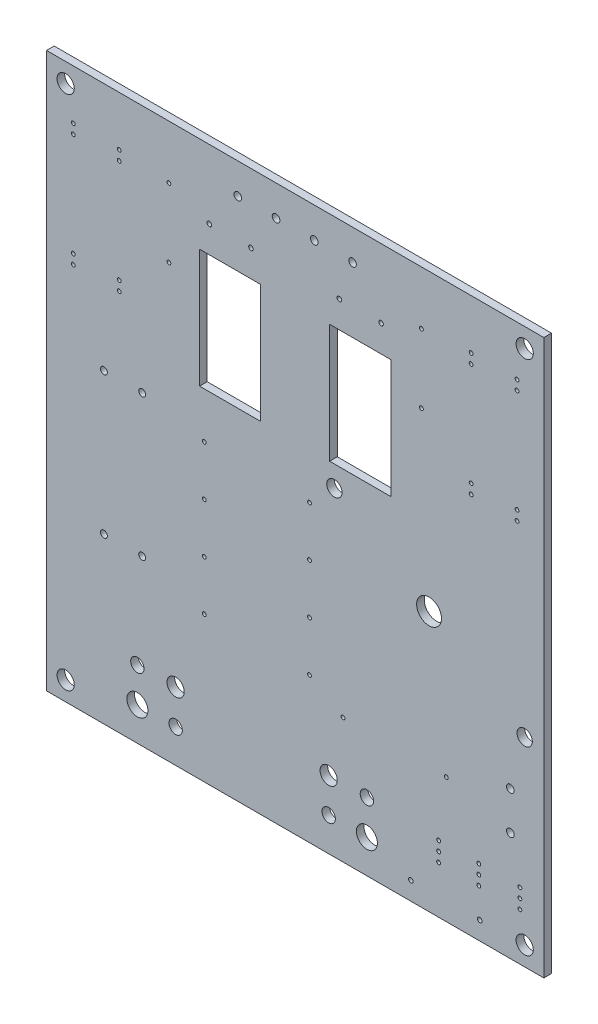
from build123d import *

# Parameters (mm, degrees)
SKETCH_1_W          = 130
SKETCH_1_H          = 145
SKETCH_1_R          = 2.25
SKETCH_1_R_2        = 3.25
EXTRUDE_1_DEPTH     = 2
SKETCH_2_R          = 1.75
SKETCH_2_R_2        = 0.5
SKETCH_2_R_3        = 1
SKETCH_2_R_4        = 2
SKETCH_2_R_5        = 2.75
SKETCH_2_R_6        = 2.25
CUT_EXTRUDE_1_DEPTH = 2
SKETCH_3_R          = 1
SKETCH_3_R_2        = 0.6
SKETCH_3_W          = 16
SKETCH_3_H          = 31
CUT_EXTRUDE_2_DEPTH = 2
SKETCH_4_R          = 0.9
SKETCH_4_R_2        = 0.5
SKETCH_4_R_3        = 0.6
CUT_EXTRUDE_3_DEPTH = 2
SKETCH_5_R          = 0.5
CUT_EXTRUDE_4_DEPTH = 2


with BuildPart() as part:
    # Эскиз1 → Вытянуть1 (new body)
    with BuildSketch(Plane.XY):
        Rectangle(SKETCH_1_W, SKETCH_1_H)
        with Locations((-60, -67.5)):
            Circle(SKETCH_1_R, mode=Mode.SUBTRACT)
        with Locations((60, -67.5)):
            Circle(SKETCH_1_R, mode=Mode.SUBTRACT)
        with Locations((60, 67.5)):
            Circle(SKETCH_1_R, mode=Mode.SUBTRACT)
        with Locations((-60, 67.5)):
            Circle(SKETCH_1_R, mode=Mode.SUBTRACT)
        with Locations((35, -4.5)):
            Circle(SKETCH_1_R_2, mode=Mode.SUBTRACT)
    extrude(amount=EXTRUDE_1_DEPTH)

    # Эскиз2 → Вырез-Вытянуть1 (cut)
    with BuildSketch(Plane.XY.offset(2)):
        with Locations((-41.25, -54.75)):
            Circle(SKETCH_2_R)
        with Locations((18.75, -54.75)):
            Circle(SKETCH_2_R)
        with Locations((37.5, -55.08)):
            Circle(SKETCH_2_R_2)
        with Locations((37.5, -57.58)):
            Circle(SKETCH_2_R_2)
        with Locations((37.5, -60.08)):
            Circle(SKETCH_2_R_2)
        with Locations((48, -57.58)):
            Circle(SKETCH_2_R_2)
        with Locations((48, -60.08)):
            Circle(SKETCH_2_R_2)
        with Locations((48, -55.08)):
            Circle(SKETCH_2_R_2)
        with Locations((58.75, -55.08)):
            Circle(SKETCH_2_R_2)
        with Locations((58.75, -57.58)):
            Circle(SKETCH_2_R_2)
        with Locations((58.75, -60.08)):
            Circle(SKETCH_2_R_2)
        with Locations((-15, 64.5)):
            Circle(SKETCH_2_R_3)
        with Locations((-5, 64.5)):
            Circle(SKETCH_2_R_3)
        with Locations((5, 64.5)):
            Circle(SKETCH_2_R_3)
        with Locations((15, 64.5)):
            Circle(SKETCH_2_R_3)
        with Locations((60, -20.5)):
            Circle(SKETCH_2_R_4)
        with Locations((10.25, 11)):
            Circle(SKETCH_2_R_4)
        with Locations((-41.25, -63.75)):
            Circle(SKETCH_2_R_5)
        with Locations((18.75, -63.75)):
            Circle(SKETCH_2_R_5)
        with Locations((-31.25, -63.75)):
            Circle(SKETCH_2_R)
        with Locations((8.75, -63.75)):
            Circle(SKETCH_2_R)
        with Locations((8.75, -54.75)):
            Circle(SKETCH_2_R_6)
        with Locations((-31.25, -54.75)):
            Circle(SKETCH_2_R_6)
    extrude(amount=-CUT_EXTRUDE_1_DEPTH, mode=Mode.SUBTRACT)

    # Эскиз3 → Вырез-Вытянуть2 (cut)
    with BuildSketch(Plane.XY.offset(2)):
        with Locations((56.25, -34)):
            Circle(SKETCH_3_R)
        with Locations((-22.45, 54.5)):
            Circle(SKETCH_3_R_2)
        with Locations((-11.55, 54.5)):
            Circle(SKETCH_3_R_2)
        with Locations((11.55, 54.5)):
            Circle(SKETCH_3_R_2)
        with Locations((22.45, 54.5)):
            Circle(SKETCH_3_R_2)
        with Locations((56.25, -44)):
            Circle(SKETCH_3_R)
        with Locations((17, 32)):
            Rectangle(SKETCH_3_W, SKETCH_3_H)
        with Locations((-17, 32)):
            Rectangle(SKETCH_3_W, SKETCH_3_H)
    extrude(amount=-CUT_EXTRUDE_2_DEPTH, mode=Mode.SUBTRACT)

    # Эскиз4 → Вырез-Вытянуть3 (cut)
    with BuildSketch(Plane.XY.offset(2)):
        with Locations((-50, 7.5)):
            Circle(SKETCH_4_R)
        with Locations((-40, 7.5)):
            Circle(SKETCH_4_R)
        with Locations((-40, -29.5)):
            Circle(SKETCH_4_R)
        with Locations((-50, -29.5)):
            Circle(SKETCH_4_R)
        with Locations((-23.75, -21.5)):
            Circle(SKETCH_4_R_2)
        with Locations((3.75, -21.5)):
            Circle(SKETCH_4_R_2)
        with Locations((-23.75, -34.5)):
            Circle(SKETCH_4_R_2)
        with Locations((3.75, -34.5)):
            Circle(SKETCH_4_R_2)
        with Locations((-23.75, -8.5)):
            Circle(SKETCH_4_R_2)
        with Locations((3.75, -8.5)):
            Circle(SKETCH_4_R_2)
        with Locations((-23.75, 4.5)):
            Circle(SKETCH_4_R_2)
        with Locations((3.75, 4.5)):
            Circle(SKETCH_4_R_2)
        with Locations((30.25, -67.75)):
            Circle(SKETCH_4_R_3)
        with Locations((48.25, -67.75)):
            Circle(SKETCH_4_R_3)
        with Locations((33, 40.5)):
            Circle(SKETCH_4_R_2)
        with Locations((33, 58.5)):
            Circle(SKETCH_4_R_2)
        with Locations((-33, 40.5)):
            Circle(SKETCH_4_R_2)
        with Locations((-33, 58.5)):
            Circle(SKETCH_4_R_2)
    extrude(amount=-CUT_EXTRUDE_3_DEPTH, mode=Mode.SUBTRACT)

    # Эскиз5 → Вырез-Вытянуть4 (cut)
    with BuildSketch(Plane.XY.offset(2)):
        with Locations((-58, 30)):
            Circle(SKETCH_5_R)
        with Locations((-58, 57)):
            Circle(SKETCH_5_R)
        with Locations((-46, 30)):
            Circle(SKETCH_5_R)
        with Locations((-46, 57)):
            Circle(SKETCH_5_R)
        with Locations((46, 30)):
            Circle(SKETCH_5_R)
        with Locations((46, 57)):
            Circle(SKETCH_5_R)
        with Locations((58, 30)):
            Circle(SKETCH_5_R)
        with Locations((58, 57)):
            Circle(SKETCH_5_R)
        with Locations((-58, 27.5)):
            Circle(SKETCH_5_R)
        with Locations((-58, 59.5)):
            Circle(SKETCH_5_R)
        with Locations((-46, 59.5)):
            Circle(SKETCH_5_R)
        with Locations((-46, 27.5)):
            Circle(SKETCH_5_R)
        with Locations((46, 59.5)):
            Circle(SKETCH_5_R)
        with Locations((58, 59.5)):
            Circle(SKETCH_5_R)
        with Locations((46, 27.5)):
            Circle(SKETCH_5_R)
        with Locations((58, 27.5)):
            Circle(SKETCH_5_R)
        with Locations((12.5, -39.75)):
            Circle(SKETCH_5_R)
        with Locations((39.5, -39.75)):
            Circle(SKETCH_5_R)
    extrude(amount=-CUT_EXTRUDE_4_DEPTH, mode=Mode.SUBTRACT)


solid = part.part
